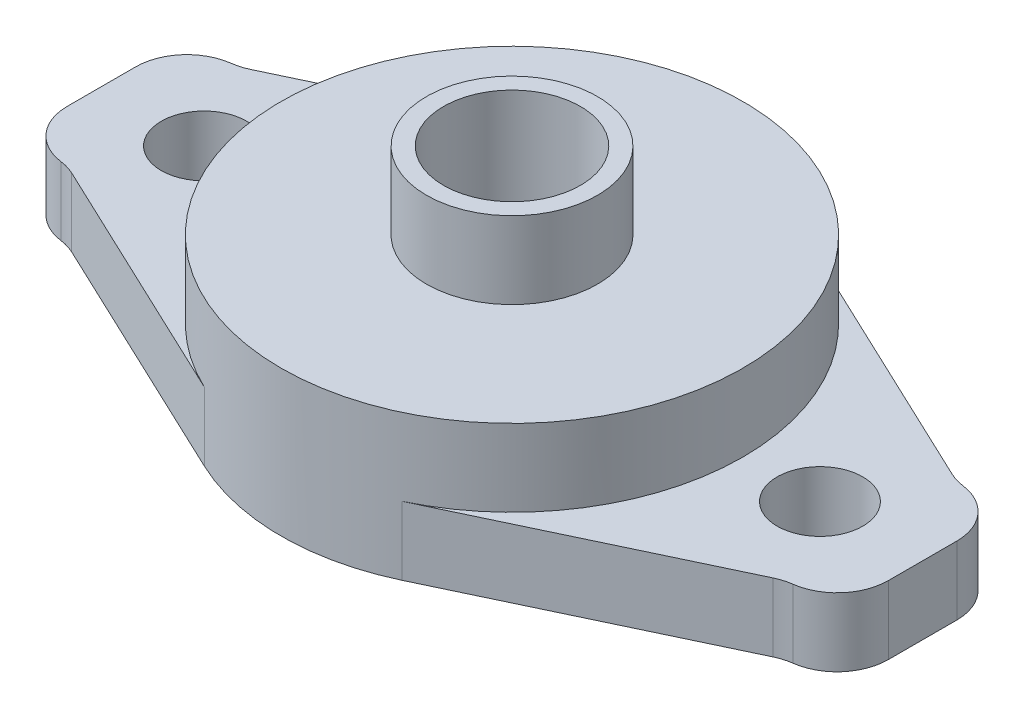
from build123d import *

# Parameters (mm, degrees)
SKETCH_1_R      = 2.5
SKETCH_1_R_2    = 4
EXTRUDE_1_DEPTH = 4
SKETCH_2_R      = 13.5
SKETCH_2_R_2    = 4
EXTRUDE_2_DEPTH = 4.5
SKETCH_3_R      = 5
SKETCH_3_R_2    = 4
EXTRUDE_3_DEPTH = 4.5


with BuildPart() as part:
    # 草图1 → 凸台-拉伸1 (new body)
    with BuildSketch(Plane(origin=(0, 0, 0), x_dir=(1, 0, 0), z_dir=(0, 1, 0))):
        with BuildLine():
            Line((-5.773005503, 12.203376888), (-20.499093296, 5.236962046))
            ThreePointArc((-20.499093296, 5.236962046), (-20.934809728, 5.070925602), (-21.390991704, 4.974411789))
            ThreePointArc((-21.390991704, 4.974411789), (-23.255324268, 3.978259954), (-24, 2))
            Line((-24, 2), (-24, -2))
            ThreePointArc((-24, -2), (-23.255324268, -3.978259954), (-21.390991704, -4.974411789))
            ThreePointArc((-21.390991704, -4.974411789), (-20.934809728, -5.070925602), (-20.499093296, -5.236962046))
            Line((-20.499093296, -5.236962046), (-5.773005503, -12.203376888))
            ThreePointArc((-5.773005503, -12.203376888), (0, -13.5), (5.773005503, -12.203376888))
            Line((5.773005503, -12.203376888), (20.499093296, -5.236962046))
            ThreePointArc((20.499093296, -5.236962046), (20.934809728, -5.070925602), (21.390991704, -4.974411789))
            ThreePointArc((21.390991704, -4.974411789), (23.255324268, -3.978259954), (24, -2))
            Line((24, -2), (24, 2))
            ThreePointArc((24, 2), (23.255324268, 3.978259954), (21.390991704, 4.974411789))
            ThreePointArc((21.390991704, 4.974411789), (20.934809728, 5.070925602), (20.499093296, 5.236962046))
            Line((20.499093296, 5.236962046), (5.773005503, 12.203376888))
            ThreePointArc((5.773005503, 12.203376888), (0, 13.5), (-5.773005503, 12.203376888))
        make_face()
        with Locations(Location((-18, 0, 0), (0, 0, 270))):
            Circle(SKETCH_1_R, mode=Mode.SUBTRACT)
        with Locations(Location((0, 0, 0), (0, 0, 270))):
            Circle(SKETCH_1_R_2, mode=Mode.SUBTRACT)
        with Locations(Location((18, 0, 0), (0, 0, 270))):
            Circle(SKETCH_1_R, mode=Mode.SUBTRACT)
    extrude(amount=EXTRUDE_1_DEPTH)

    # 草图2 → 凸台-拉伸2 (add)
    with BuildSketch(Plane(origin=(0, 4, 0), x_dir=(1, 0, 0), z_dir=(0, 1, 0))):
        with Locations(Location((0, 0, 0), (0, 0, 64.68274989))):
            Circle(SKETCH_2_R)
        with Locations(Location((0, 0, 0), (0, 0, 270))):
            Circle(SKETCH_2_R_2, mode=Mode.SUBTRACT)
    extrude(amount=EXTRUDE_2_DEPTH)

    # 草图3 → 凸台-拉伸3 (add)
    with BuildSketch(Plane(origin=(0, 8.5, 0), x_dir=(1, 0, 0), z_dir=(0, 1, 0))):
        with Locations(Location((0, 0, 0), (0, 0, 270))):
            Circle(SKETCH_3_R)
        with Locations(Location((0, 0, 0), (0, 0, 270))):
            Circle(SKETCH_3_R_2, mode=Mode.SUBTRACT)
    extrude(amount=EXTRUDE_3_DEPTH)


solid = part.part
